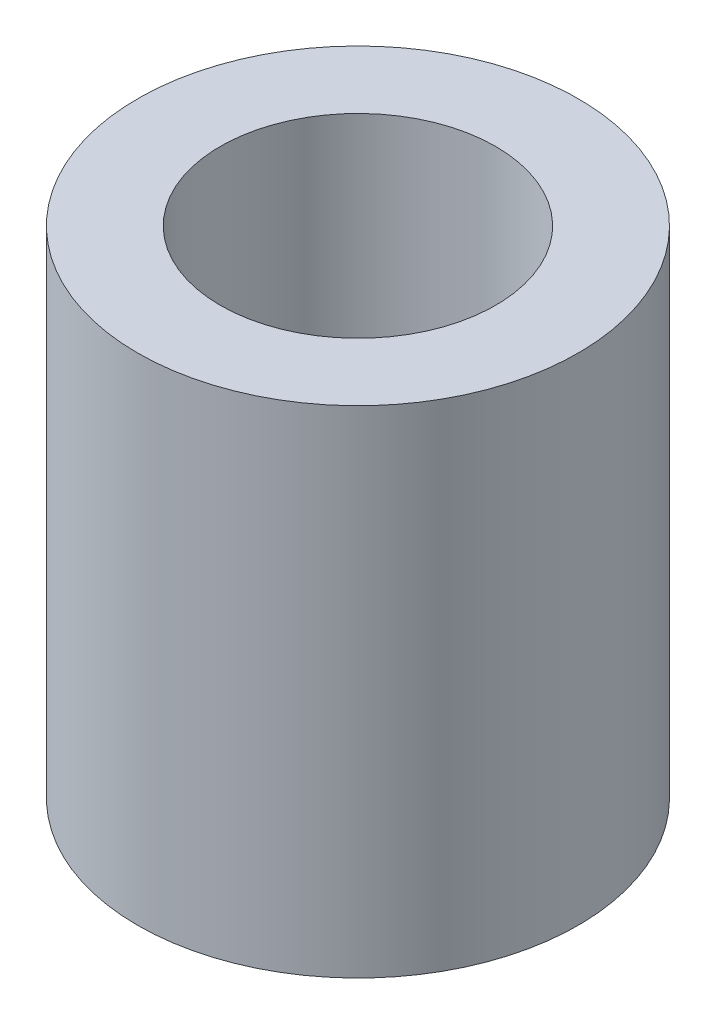
from build123d import *

# Parameters (mm, degrees)
SKETCH1_R           = 4
SKETCH1_R_2         = 2.5
BOSS_EXTRUDE1_DEPTH = 9


with BuildPart() as part:
    # Sketch1 → Boss-Extrude1 (new body)
    with BuildSketch(Plane(origin=(0, 0, 0), x_dir=(1, 0, 0), z_dir=(0, 1, 0))):
        with Locations(Location((0, 0, 0), (0, 0, 270))):
            Circle(SKETCH1_R)
        with Locations(Location((0, 0, 0), (0, 0, 270))):
            Circle(SKETCH1_R_2, mode=Mode.SUBTRACT)
    extrude(amount=BOSS_EXTRUDE1_DEPTH)


solid = part.part
